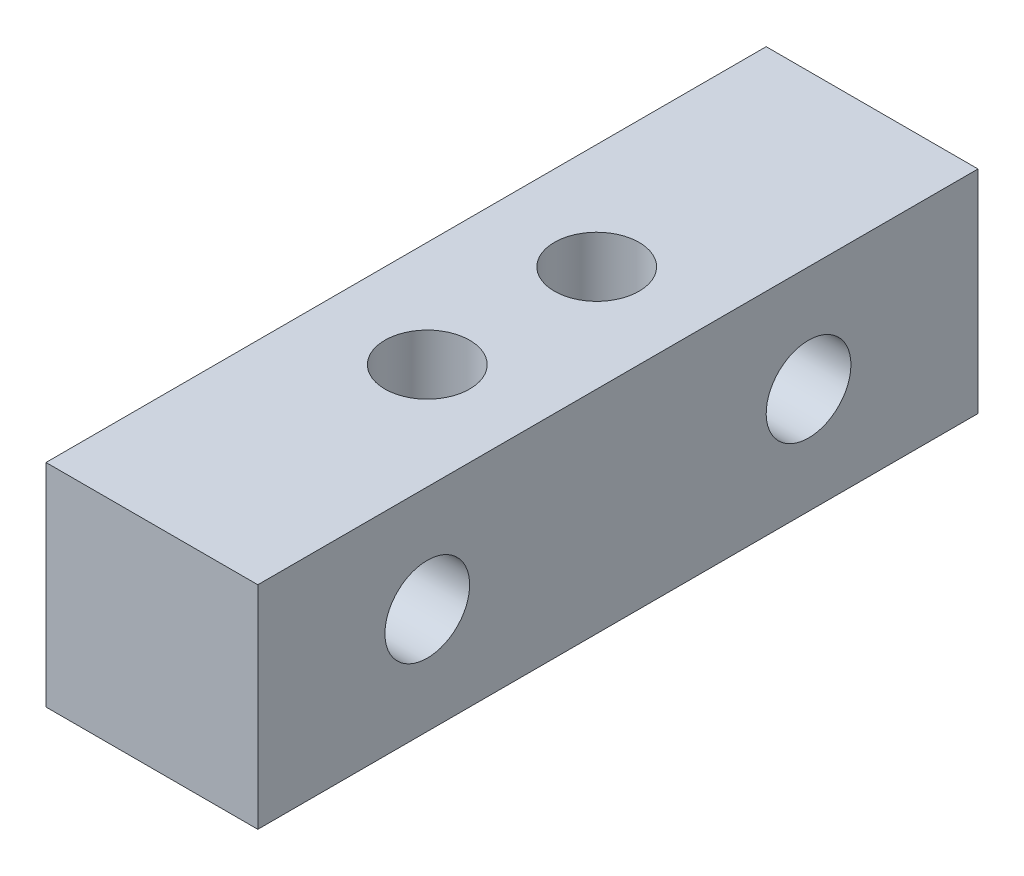
from build123d import *

# Parameters (mm, degrees)
SKETCH_1_W          = 10
SKETCH_1_H          = 10
EXTRUDE_1_DEPTH     = 34
SKETCH_2_R          = 2
CUT_EXTRUDE_1_DEPTH = 37.823905279
SKETCH_3_R          = 2
CUT_EXTRUDE_2_DEPTH = 37.823905279


with BuildPart() as part:
    # 草图1 → 凸台-拉伸1 (new body)
    with BuildSketch(Plane.XY):
        with Locations((5, -5)):
            Rectangle(SKETCH_1_W, SKETCH_1_H)
    extrude(amount=EXTRUDE_1_DEPTH)

    # 草图2 → 切除-拉伸1 (cut, through all)
    with BuildSketch(Plane(origin=(10, 0, 0), x_dir=(0, 0, -1), z_dir=(1, 0, 0))):
        with Locations(Location((-26, -5, 0), (0, 0, 90))):
            Circle(SKETCH_2_R)
        with Locations(Location((-8, -5, 0), (0, 0, 90))):
            Circle(SKETCH_2_R)
    extrude(amount=-CUT_EXTRUDE_1_DEPTH, mode=Mode.SUBTRACT)

    # 草图3 → 切除-拉伸2 (cut, through all)
    with BuildSketch(Plane(origin=(0, 0, 0), x_dir=(1, 0, 0), z_dir=(0, 1, 0))):
        with Locations(Location((5, -13, 0), (0, 0, 270))):
            Circle(SKETCH_3_R)
        with Locations(Location((5, -21, 0), (0, 0, 270))):
            Circle(SKETCH_3_R)
    extrude(amount=-CUT_EXTRUDE_2_DEPTH, mode=Mode.SUBTRACT)


solid = part.part
